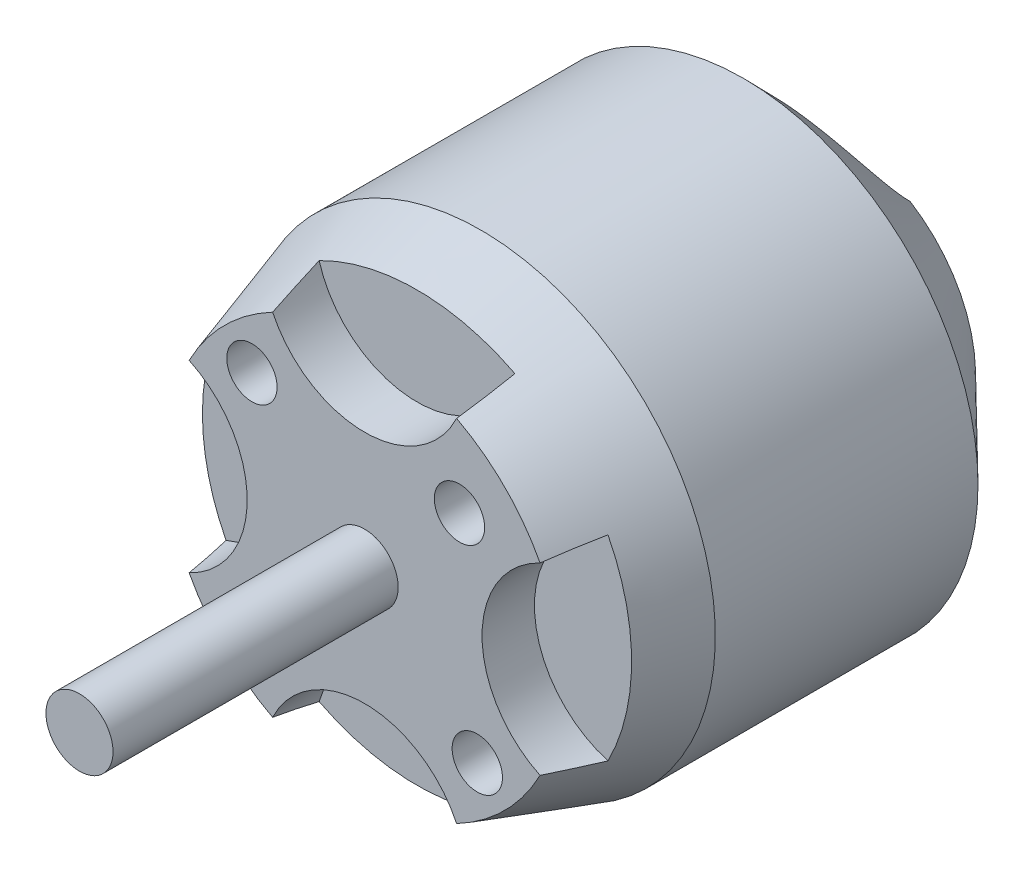
from build123d import *

# Parameters (mm, degrees)
SKETCH1_R           = 13.98905
BOSS_EXTRUDE1_DEPTH = 15.6591
SKETCH2_R           = 11.811
SKETCH4_R           = 8.255
SKETCH5_R           = 4.5085
BOSS_EXTRUDE2_DEPTH = 2.286
CUT_EXTRUDE1_DEPTH  = 9.144
CIRPATTERN1_COUNT   = 3
SKETCH7_R           = 6.075765912
CUT_EXTRUDE2_DEPTH  = 3.1242
CIRPATTERN2_COUNT   = 4
SKETCH8_R           = 2
BOSS_EXTRUDE3_DEPTH = 17
SKETCH9_R           = 1.5
CUT_EXTRUDE3_DEPTH  = 8.11


with BuildPart() as part:
    # Sketch1 → Boss-Extrude1 (new body)
    with BuildSketch(Plane.XY):
        Circle(SKETCH1_R)
    extrude(amount=BOSS_EXTRUDE1_DEPTH)

    # Sketch2 → section 1 of loft1
    with BuildSketch(Plane.XY.offset(22.5806), mode=Mode.PRIVATE) as loft1_s1:
        Circle(SKETCH2_R)
    # loft up to a face of the part (loft1)
    loft([Face(Wire([part.edges().sort_by_distance((-9.576163692, 10.197578577, 15.6591))[0]])), loft1_s1.sketch])

    # Sketch4 → section 1 of loft2
    with BuildSketch(Plane(origin=(0, 0, -5.588), x_dir=(-1, 0, 0), z_dir=(0, 0, -1)), mode=Mode.PRIVATE) as loft2_s1:
        Circle(SKETCH4_R)
    # loft up to a face of the part (loft2)
    loft([Face(Wire([part.edges().sort_by_distance((-9.576163692, -10.197578577, 0))[0]])), loft2_s1.sketch])

    # Sketch5 → Boss-Extrude2 (add)
    with BuildSketch(Plane(origin=(0, 0, -5.588), x_dir=(-1, 0, 0), z_dir=(0, 0, -1))):
        Circle(SKETCH5_R)
    extrude(amount=BOSS_EXTRUDE2_DEPTH)

    # Sketch6 → Cut-Extrude1 (cut)
    with BuildSketch(Plane(origin=(0, 0, -5.588), x_dir=(-1, 0, 0), z_dir=(0, 0, -1))):
        with BuildLine():
            Line((-0.722628041, 12.2555), (0.722628041, 12.2555))
            ThreePointArc((0.722628041, 12.2555), (4.596128041, 8.382), (0.722628041, 4.5085))
            Line((0.722628041, 4.5085), (-0.722628041, 4.5085))
            ThreePointArc((-0.722628041, 4.5085), (-4.596128041, 8.382), (-0.722628041, 12.2555))
        make_face()
    cut_extrude1 = extrude(amount=-CUT_EXTRUDE1_DEPTH, mode=Mode.SUBTRACT)

    # CirPattern1: Cut-Extrude1 ×3 about axis
    cirpattern1_axis = Axis((0, 0, 15.6591), (0, 0, -1))
    for i in range(1, CIRPATTERN1_COUNT):
        add(cut_extrude1.rotate(cirpattern1_axis, i * 360 / CIRPATTERN1_COUNT), mode=Mode.SUBTRACT)

    # Sketch7 → Cut-Extrude2 (cut)
    with BuildSketch(Plane.XY.offset(22.5806)):
        with Locations((0, 13.075508189)):
            Circle(SKETCH7_R)
    cut_extrude2 = extrude(amount=-CUT_EXTRUDE2_DEPTH, mode=Mode.SUBTRACT)

    # CirPattern2: Cut-Extrude2 ×4 about axis
    cirpattern2_axis = Axis((0, 0, 15.6591), (0, 0, -1))
    for i in range(1, CIRPATTERN2_COUNT):
        add(cut_extrude2.rotate(cirpattern2_axis, i * 360 / CIRPATTERN2_COUNT), mode=Mode.SUBTRACT)

    # Sketch8 → Boss-Extrude3 (add)
    with BuildSketch(Plane.XY.offset(22.5806)):
        Circle(SKETCH8_R)
    extrude(amount=BOSS_EXTRUDE3_DEPTH)

    # Sketch9 → Cut-Extrude3 (cut)
    with BuildSketch(Plane.XY.offset(22.5806)):
        with Locations((-6.717514421, 6.717514421)):
            Circle(SKETCH9_R)
        with Locations((6.717514421, -6.717514421)):
            Circle(SKETCH9_R)
        with Locations((5.656854249, 5.656854249)):
            Circle(SKETCH9_R)
        with Locations((-5.656854249, -5.656854249)):
            Circle(SKETCH9_R)
    extrude(amount=-CUT_EXTRUDE3_DEPTH, mode=Mode.SUBTRACT)


solid = part.part
